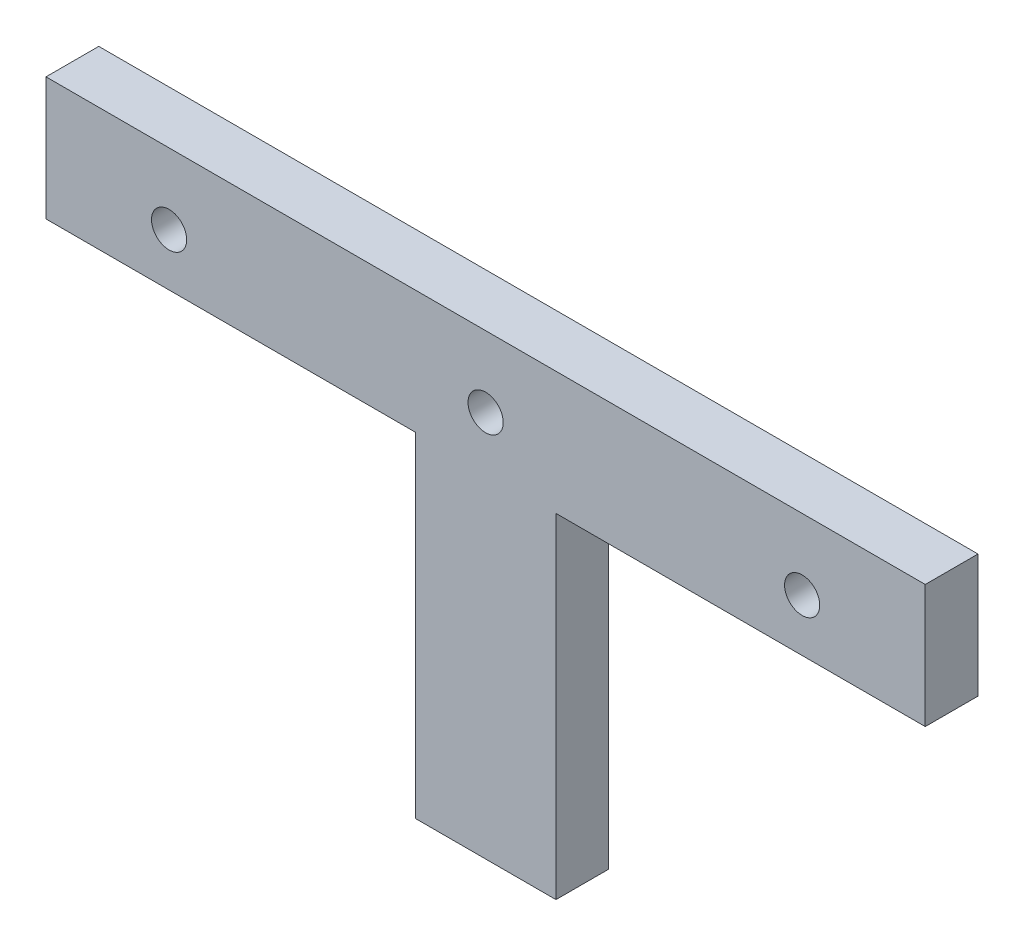
from build123d import *

# Parameters (mm, degrees)
EXTRUDE_1_DEPTH     = 15
SKETCH_2_R          = 5
CUT_EXTRUDE_1_DEPTH = 212.504412291


with BuildPart() as part:
    # 草圖1 → 填料-伸長1 (new body)
    with BuildSketch(Plane.XY):
        Polygon((-15.155141061, 7.219614063), (-55.155141061, 7.219614063), (-55.155141061, 102.329702578), (-160.155141061, 102.329702578), (-160.155141061, 137.329702578), (89.844858939, 137.329702578), (89.844858939, 102.329702578), (-15.155141061, 102.329702578), align=None)
    extrude(amount=EXTRUDE_1_DEPTH)

    # 草圖2 → 除料-伸長1 (cut, through all)
    with BuildSketch(Plane.XY.offset(15)):
        with Locations((54.844858939, 117.189491535)):
            Circle(SKETCH_2_R)
        with Locations((-35.155141061, 117.189491535)):
            Circle(SKETCH_2_R)
        with Locations((-125.155141061, 117.189491535)):
            Circle(SKETCH_2_R)
    extrude(amount=-CUT_EXTRUDE_1_DEPTH, mode=Mode.SUBTRACT)


solid = part.part
